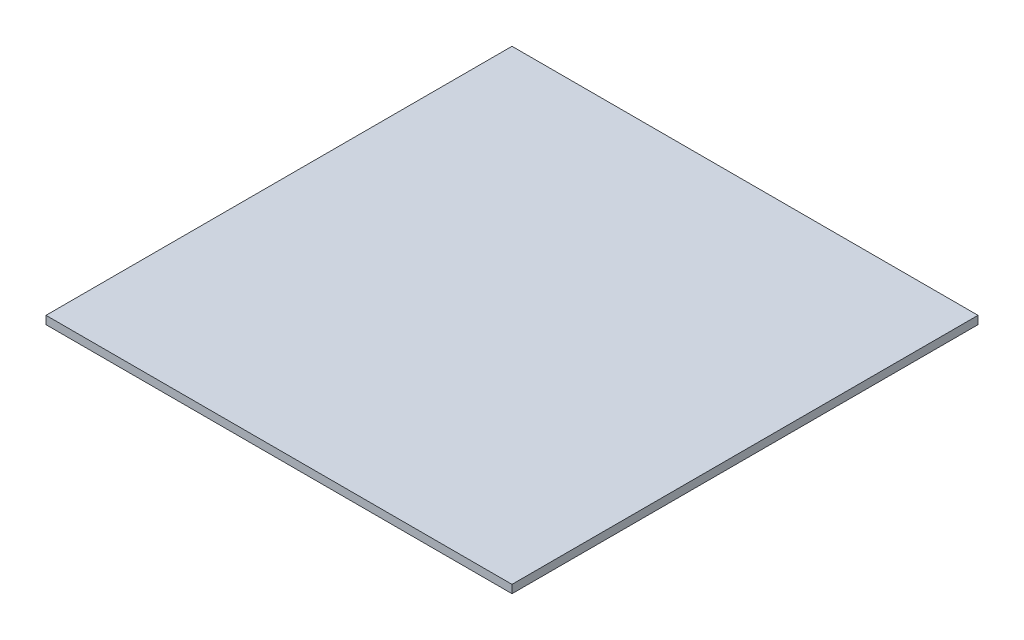
from build123d import *

# Parameters (mm, degrees)
SKETCH1_W           = 860
SKETCH1_H           = 860
BOSS_EXTRUDE1_DEPTH = 15


with BuildPart() as part:
    # Sketch1 → Boss-Extrude1 (new body)
    with BuildSketch(Plane(origin=(0, 0, 0), x_dir=(1, 0, 0), z_dir=(0, 1, 0))):
        with Locations((634.350519278, 4089.85577217)):
            Rectangle(SKETCH1_W, SKETCH1_H)
    extrude(amount=BOSS_EXTRUDE1_DEPTH)


solid = part.part
